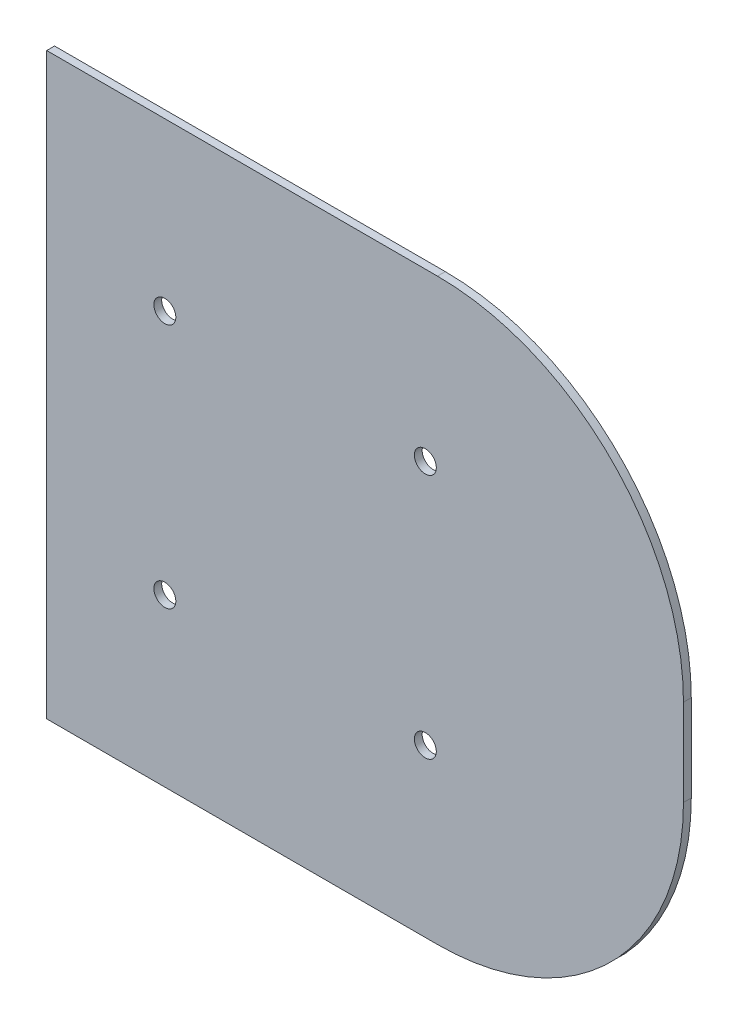
from build123d import *

# Parameters (mm, degrees)
Y_KSEKLIK_EKSTR_ZYON3_DEPTH = 2.7
IZIM2_R                     = 3.79
KES_EKSTR_ZYON1_DEPTH       = 2.75


with BuildPart() as part:
    # Çizim1 → Yükseklik-Ekstrüzyon3 (new body)
    with BuildSketch(Plane.XY):
        with BuildLine():
            Line((-110, -100), (25, -100))
            ThreePointArc((25, -100), (85.104076401, -75.104076401), (110, -15))
            Line((110, -15), (110, 15))
            ThreePointArc((110, 15), (85.104076401, 75.104076401), (25, 100))
            Line((25, 100), (-110, 100))
            Line((-110, 100), (-110, -100))
        make_face()
    extrude(amount=Y_KSEKLIK_EKSTR_ZYON3_DEPTH)

    # Çizim2 → Kes-Ekstrüzyon1 (cut)
    with BuildSketch(Plane.XY.offset(2.7)):
        with Locations((-69.187191481, 42.468560625)):
            Circle(IZIM2_R)
        with Locations((20.812808519, 42.468560625)):
            Circle(IZIM2_R)
        with Locations(Location((20.812808519, -42.468560625, 0), (0, 0, 180))):
            Circle(IZIM2_R)
        with Locations(Location((-69.187191481, -42.468560625, 0), (0, 0, 180))):
            Circle(IZIM2_R)
    extrude(amount=-KES_EKSTR_ZYON1_DEPTH, mode=Mode.SUBTRACT)


solid = part.part
